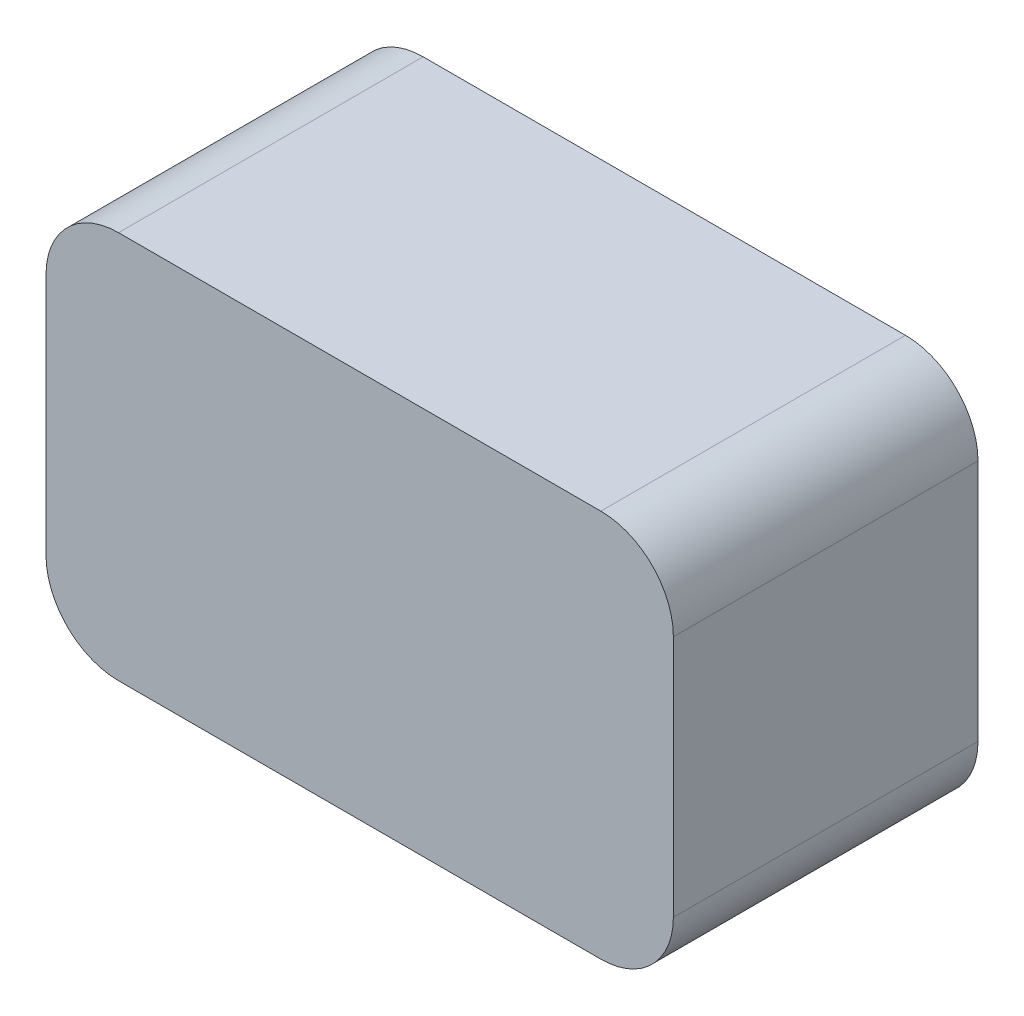
from build123d import *

# Parameters (mm, degrees)
DODANIE_WYCI_GNI_CIE1_DEPTH = 42


with BuildPart() as part:
    # Szkic1 → Dodanie-wyciągnięcie1 (new body)
    with BuildSketch(Plane.XY):
        with BuildLine():
            Line((-42.235100951, 15.429073034), (24.264899049, 15.429073034))
            ThreePointArc((24.264899049, 15.429073034), (31.335966861, 12.500140846), (34.264899049, 5.429073034))
            Line((34.264899049, 5.429073034), (34.264899049, -28.070926966))
            ThreePointArc((34.264899049, -28.070926966), (31.335966861, -35.141994778), (24.264899049, -38.070926966))
            Line((24.264899049, -38.070926966), (-42.235100951, -38.070926966))
            ThreePointArc((-42.235100951, -38.070926966), (-49.306168763, -35.141994778), (-52.235100951, -28.070926966))
            Line((-52.235100951, -28.070926966), (-52.235100951, 5.429073034))
            ThreePointArc((-52.235100951, 5.429073034), (-49.306168763, 12.500140846), (-42.235100951, 15.429073034))
        make_face()
    extrude(amount=DODANIE_WYCI_GNI_CIE1_DEPTH)


solid = part.part
